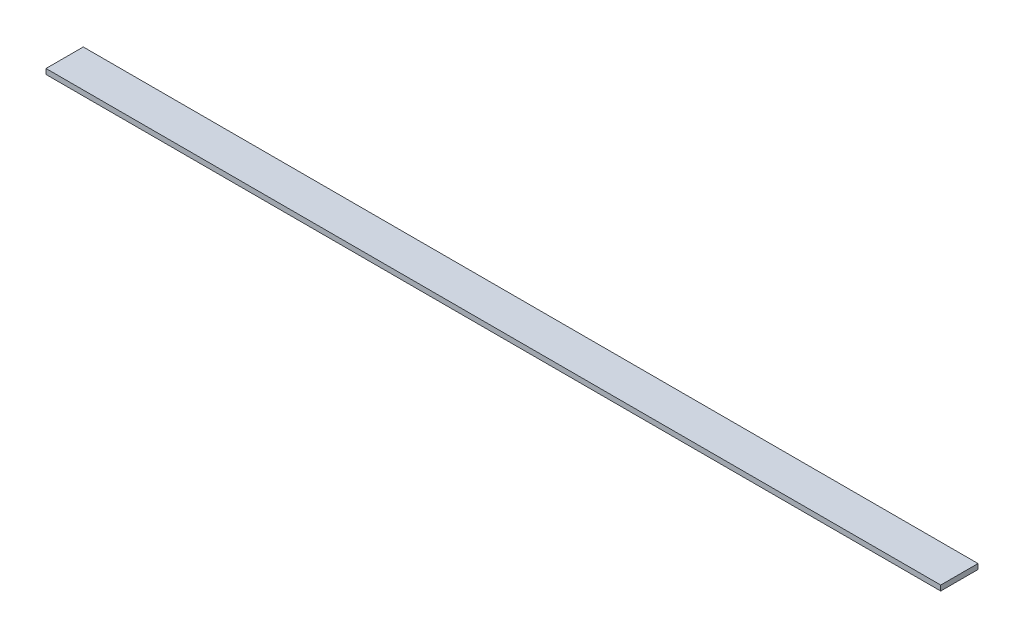
from build123d import *

# Parameters (mm, degrees)
SKETCH1_W           = 120
SKETCH1_H           = 5
BOSS_EXTRUDE1_DEPTH = 0.7


with BuildPart() as part:
    # Sketch1 → Boss-Extrude1 (new body)
    with BuildSketch(Plane(origin=(0, 0, 0), x_dir=(1, 0, 0), z_dir=(0, 1, 0))):
        Rectangle(SKETCH1_W, SKETCH1_H)
    extrude(amount=BOSS_EXTRUDE1_DEPTH)


solid = part.part
